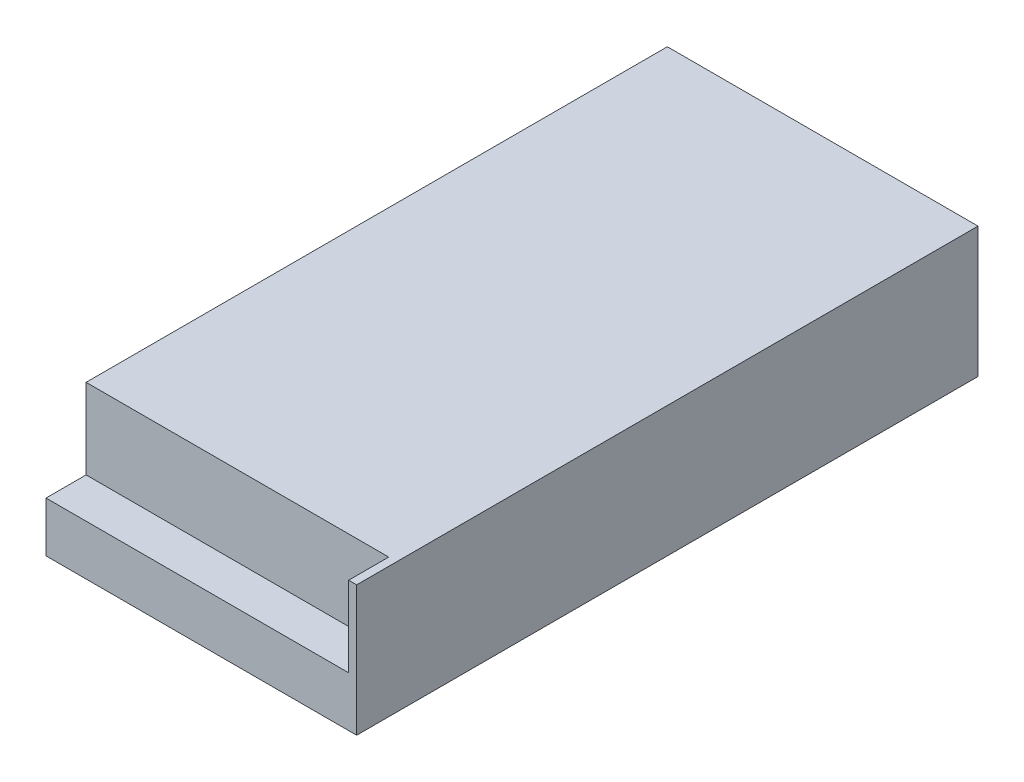
from build123d import *

# Parameters (mm, degrees)
SKETCH1_W           = 98.425
SKETCH1_H           = 196.85
BOSS_EXTRUDE1_DEPTH = 41.275
CUT_EXTRUDE1_START  = -98.425
SKETCH2_W           = 12.7
SKETCH2_H           = 25.4
CUT_EXTRUDE1_DEPTH  = 95.885


with BuildPart() as part:
    # Sketch1 → Boss-Extrude1 (new body)
    with BuildSketch(Plane(origin=(0, 0, 0), x_dir=(1, 0, 0), z_dir=(0, 1, 0))):
        with Locations((49.2125, 98.425)):
            Rectangle(SKETCH1_W, SKETCH1_H)
    extrude(amount=BOSS_EXTRUDE1_DEPTH)

    # Sketch2 → Cut-Extrude1 (cut)
    with BuildSketch(Plane(origin=(98.425, 0, 0), x_dir=(0, 0, -1), z_dir=(1, 0, 0)).offset(CUT_EXTRUDE1_START)):
        with Locations((6.35, 28.575)):
            Rectangle(SKETCH2_W, SKETCH2_H)
    extrude(amount=CUT_EXTRUDE1_DEPTH, mode=Mode.SUBTRACT)


solid = part.part
